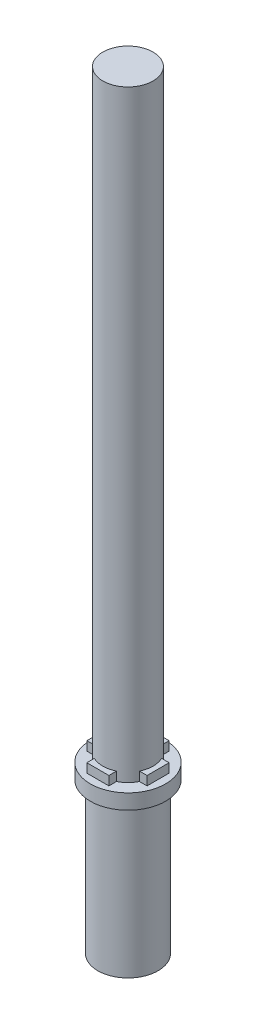
from build123d import *

# Parameters (mm, degrees)
SKETCH_1_R      = 6
SKETCH_1_R_2    = 5.25
EXTRUDE_2_DEPTH = 30
SKETCH_2_R      = 7.5
EXTRUDE_3_DEPTH = 3
SKETCH_3_R      = 5
EXTRUDE_4_DEPTH = 120
EXTRUDE_6_DEPTH = 1.8


with BuildPart() as part:
    # 草图1 → 凸台-拉伸2 (new body)
    with BuildSketch(Plane(origin=(0, 0, 0), x_dir=(1, 0, 0), z_dir=(0, 1, 0))):
        with Locations(Location((0, 0, 0), (0, 0, 270))):
            Circle(SKETCH_1_R)
        with Locations(Location((0, 0, 0), (0, 0, 270))):
            Circle(SKETCH_1_R_2, mode=Mode.SUBTRACT)
    extrude(amount=EXTRUDE_2_DEPTH)

    # 草图2 → 凸台-拉伸3 (add)
    with BuildSketch(Plane(origin=(0, 30, 0), x_dir=(1, 0, 0), z_dir=(0, 1, 0))):
        with Locations(Location((0, 0, 0), (0, 0, 270))):
            Circle(SKETCH_2_R)
    extrude(amount=EXTRUDE_3_DEPTH)

    # 草图3 → 凸台-拉伸4 (add)
    with BuildSketch(Plane(origin=(0, 33, 0), x_dir=(1, 0, 0), z_dir=(0, 1, 0))):
        with Locations(Location((0, 0, 0), (0, 0, 270))):
            Circle(SKETCH_3_R)
    extrude(amount=EXTRUDE_4_DEPTH)

    # 草图4 → 凸台-拉伸6 (add)
    with BuildSketch(Plane(origin=(0, 33, 0), x_dir=(1, 0, 0), z_dir=(0, 1, 0))):
        with BuildLine():
            Line((6, 2.2), (4.489988864, 2.2))
            ThreePointArc((4.489988864, 2.2), (4.870828693, 1.129171307), (5, 0))
            ThreePointArc((5, 0), (4.870828693, -1.129171307), (4.489988864, -2.2))
            Line((4.489988864, -2.2), (6, -2.2))
            Line((6, -2.2), (6, 2.2))
        make_face()
        with BuildLine():
            ThreePointArc((2.2, -4.489988864), (0, -5), (-2.2, -4.489988864))
            Line((-2.2, -4.489988864), (-2.2, -6))
            Line((-2.2, -6), (2.2, -6))
            Line((2.2, -6), (2.2, -4.489988864))
        make_face()
        with BuildLine():
            Line((-2.2, 6), (-2.2, 4.489988864))
            ThreePointArc((-2.2, 4.489988864), (0, 5), (2.2, 4.489988864))
            Line((2.2, 4.489988864), (2.2, 6))
            Line((2.2, 6), (-2.2, 6))
        make_face()
        with BuildLine():
            ThreePointArc((-4.489988864, -2.2), (-5, 0), (-4.489988864, 2.2))
            Line((-4.489988864, 2.2), (-6, 2.2))
            Line((-6, 2.2), (-6, -2.2))
            Line((-6, -2.2), (-4.489988864, -2.2))
        make_face()
    extrude(amount=EXTRUDE_6_DEPTH)


solid = part.part
